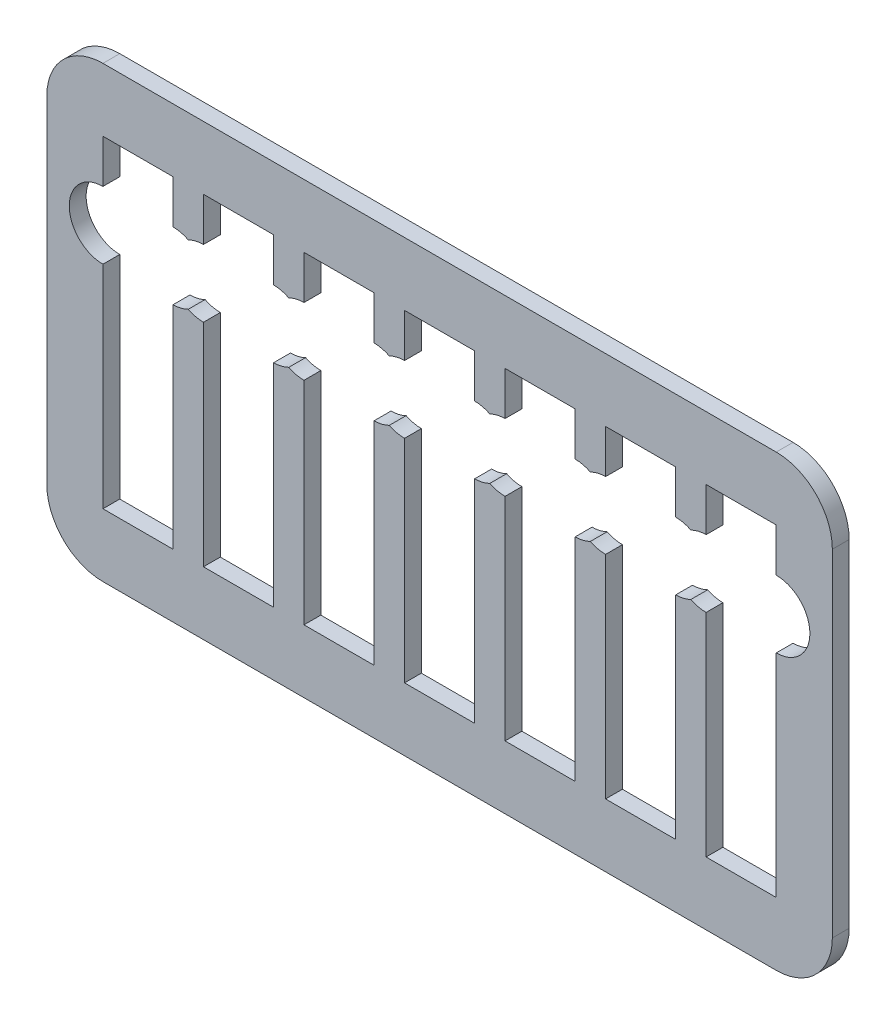
from build123d import *

# Parameters (mm, degrees)
BOSS_EXTRUDE1_DEPTH = 6
CUT_EXTRUDE1_DEPTH  = 6


with BuildPart() as part:
    # Sketch1 → Boss-Extrude1 (new body)
    with BuildSketch(Plane.XY):
        with BuildLine():
            Line((20, 0), (260, 0))
            ThreePointArc((260, 0), (274.142135624, 5.857864376), (280, 20))
            Line((280, 20), (280, 140))
            ThreePointArc((280, 140), (274.142135624, 154.142135624), (260, 160))
            Line((260, 160), (20, 160))
            ThreePointArc((20, 160), (5.857864376, 154.142135624), (0, 140))
            Line((0, 140), (0, 20))
            ThreePointArc((0, 20), (5.857864376, 5.857864376), (20, 0))
        make_face()
    extrude(amount=BOSS_EXTRUDE1_DEPTH)

    # Sketch2 → Cut-Extrude1 (cut)
    with BuildSketch(Plane.XY.offset(6)):
        with BuildLine():
            Line((20, 137.5), (45, 137.5))
            Line((45, 137.5), (45, 122))
            ThreePointArc((45, 122), (47.784318939, 121.672513356), (50.416666667, 120.707928008))
            ThreePointArc((50.416666667, 120.707928008), (53.049014395, 121.672513356), (55.833333333, 122))
            Line((55.833333333, 122), (55.833333333, 137.5))
            Line((55.833333333, 137.5), (80.833333333, 137.5))
            Line((80.833333333, 137.5), (80.833333333, 122))
            ThreePointArc((80.833333333, 122), (83.617652272, 121.672513356), (86.25, 120.707928008))
            ThreePointArc((86.25, 120.707928008), (88.882347728, 121.672513356), (91.666666667, 122))
            Line((91.666666667, 122), (91.666666667, 137.5))
            Line((91.666666667, 137.5), (116.666666667, 137.5))
            Line((116.666666667, 137.5), (116.666666667, 122))
            ThreePointArc((116.666666667, 122), (119.450985605, 121.672513356), (122.083333333, 120.707928008))
            ThreePointArc((122.083333333, 120.707928008), (124.715681061, 121.672513356), (127.5, 122))
            Line((127.5, 122), (127.5, 137.5))
            Line((127.5, 137.5), (152.5, 137.5))
            Line((152.5, 137.5), (152.5, 122))
            ThreePointArc((152.5, 122), (155.284318939, 121.672513356), (157.916666667, 120.707928008))
            ThreePointArc((157.916666667, 120.707928008), (160.549014395, 121.672513356), (163.333333333, 122))
            Line((163.333333333, 122), (163.333333333, 137.5))
            Line((163.333333333, 137.5), (188.333333333, 137.5))
            Line((188.333333333, 137.5), (188.333333333, 122))
            ThreePointArc((188.333333333, 122), (191.117652272, 121.672513356), (193.75, 120.707928008))
            ThreePointArc((193.75, 120.707928008), (196.382347728, 121.672513356), (199.166666667, 122))
            Line((199.166666667, 122), (199.166666667, 137.5))
            Line((199.166666667, 137.5), (224.166666667, 137.5))
            Line((224.166666667, 137.5), (224.166666667, 122))
            ThreePointArc((224.166666667, 122), (226.950985605, 121.672513356), (229.583333333, 120.707928008))
            ThreePointArc((229.583333333, 120.707928008), (232.215681061, 121.672513356), (235, 122))
            Line((235, 122), (235, 137.5))
            Line((235, 137.5), (260, 137.5))
            Line((260, 137.5), (260, 122))
            ThreePointArc((260, 122), (272, 110), (260, 98))
            Line((260, 98), (260, 22.5))
            Line((260, 22.5), (235, 22.5))
            Line((235, 22.5), (235, 98))
            ThreePointArc((235, 98), (232.215681061, 98.327486644), (229.583333333, 99.292071992))
            ThreePointArc((229.583333333, 99.292071992), (226.950985605, 98.327486644), (224.166666667, 98))
            Line((224.166666667, 98), (224.166666667, 22.5))
            Line((224.166666667, 22.5), (199.166666667, 22.5))
            Line((199.166666667, 22.5), (199.166666667, 98))
            ThreePointArc((199.166666667, 98), (196.382347728, 98.327486644), (193.75, 99.292071992))
            ThreePointArc((193.75, 99.292071992), (191.117652272, 98.327486644), (188.333333333, 98))
            Line((188.333333333, 98), (188.333333333, 22.5))
            Line((188.333333333, 22.5), (163.333333333, 22.5))
            Line((163.333333333, 22.5), (163.333333333, 98))
            ThreePointArc((163.333333333, 98), (160.549014395, 98.327486644), (157.916666667, 99.292071992))
            ThreePointArc((157.916666667, 99.292071992), (155.284318939, 98.327486644), (152.5, 98))
            Line((152.5, 98), (152.5, 22.5))
            Line((152.5, 22.5), (127.5, 22.5))
            Line((127.5, 22.5), (127.5, 98))
            ThreePointArc((127.5, 98), (124.715681061, 98.327486644), (122.083333333, 99.292071992))
            ThreePointArc((122.083333333, 99.292071992), (119.450985605, 98.327486644), (116.666666667, 98))
            Line((116.666666667, 98), (116.666666667, 22.5))
            Line((116.666666667, 22.5), (91.666666667, 22.5))
            Line((91.666666667, 22.5), (91.666666667, 98))
            ThreePointArc((91.666666667, 98), (88.882347728, 98.327486644), (86.25, 99.292071992))
            ThreePointArc((86.25, 99.292071992), (83.617652272, 98.327486644), (80.833333333, 98))
            Line((80.833333333, 98), (80.833333333, 22.5))
            Line((80.833333333, 22.5), (55.833333333, 22.5))
            Line((55.833333333, 22.5), (55.833333333, 98))
            ThreePointArc((55.833333333, 98), (53.049014395, 98.327486644), (50.416666667, 99.292071992))
            ThreePointArc((50.416666667, 99.292071992), (47.784318939, 98.327486644), (45, 98))
            Line((45, 98), (45, 22.5))
            Line((45, 22.5), (20, 22.5))
            Line((20, 22.5), (20, 98))
            ThreePointArc((20, 98), (8, 110), (20, 122))
            Line((20, 122), (20, 137.5))
        make_face()
    extrude(amount=-CUT_EXTRUDE1_DEPTH, mode=Mode.SUBTRACT)


solid = part.part
